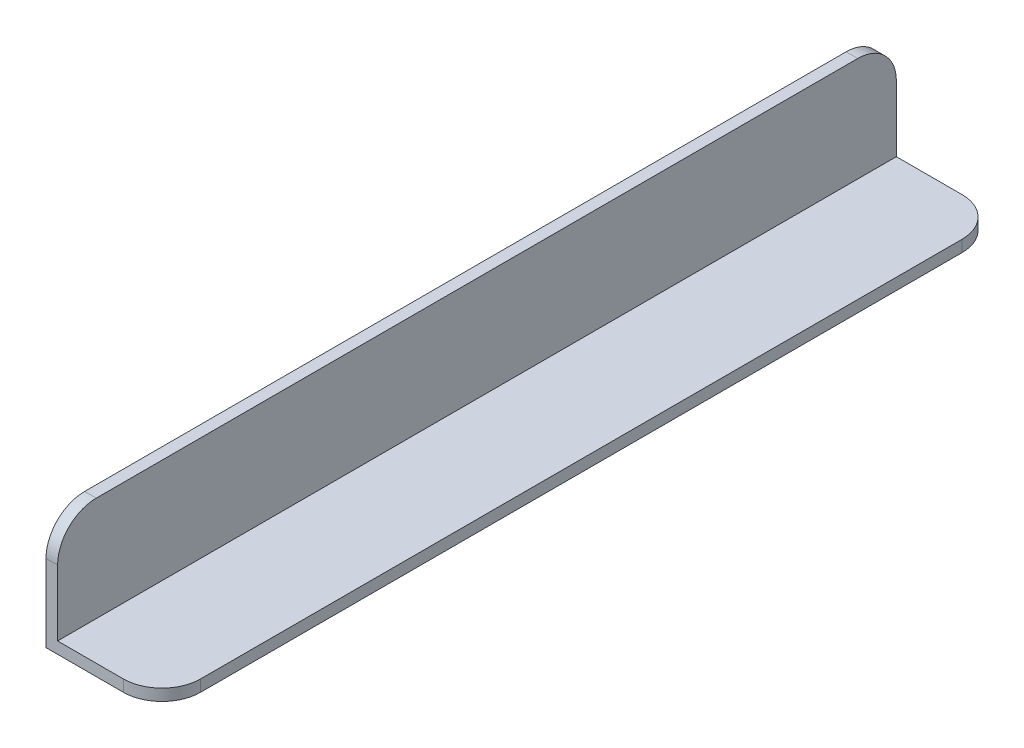
from build123d import *

# Parameters (mm, degrees)
EXTRUDE_1_DEPTH = 217
FILLET_1_R      = 20


with BuildPart() as part:
    # Эскиз1 → Бобышка-Вытянуть1 (new, symmetric)
    with BuildSketch(Plane.XY):
        Polygon((0, 0), (60, 0), (60, 6), (6, 6), (6, 60), (0, 60), align=None)
    extrude(amount=EXTRUDE_1_DEPTH, both=True)

    # Скругление1
    fillet_1_edges = [part.edges().sort_by_distance(p)[0] for p in [
        (60, 3, 217),
        (3, 60, 217),
        (3, 60, -217),
        (60, 3, -217),
    ]]
    fillet(fillet_1_edges, radius=FILLET_1_R)


solid = part.part
